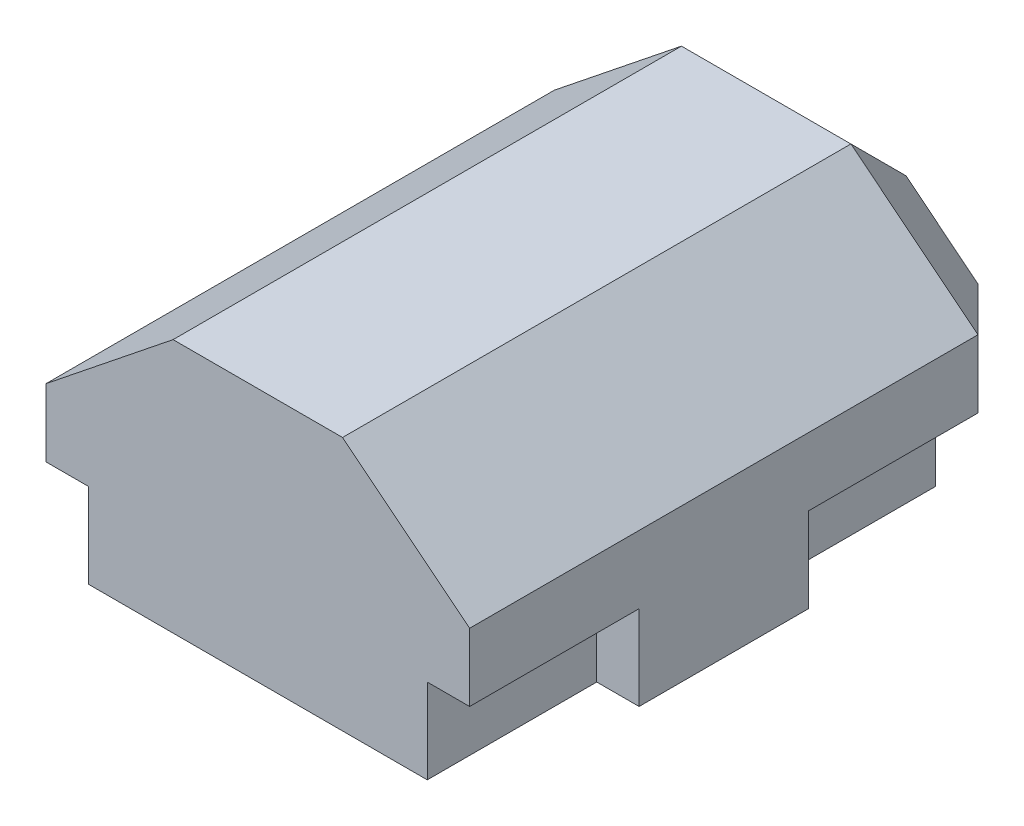
from build123d import *

# Parameters (mm, degrees)
BOSS_EXTRU_1_DEPTH = 600
ESQUISSE2_W        = 200
ESQUISSE2_H        = 100
BOSS_EXTRU_2_DEPTH = 500
BOSS_EXTRU_3_DEPTH = 100
CHANFREIN1_SIZE    = 100


with BuildPart() as part:
    # Esquisse1 → Boss.-Extru.1 (new body)
    with BuildSketch(Plane.XY):
        Polygon((-250, 30), (-100, 150), (100, 150), (250, 30), (250, -50), (200, -50), (200, -150), (-200, -150), (-200, -50), (-250, -50), align=None)
    extrude(amount=BOSS_EXTRU_1_DEPTH)

    # Esquisse2 → Boss.-Extru.2 (add)
    with BuildSketch(Plane.ZY.offset(250)):
        with Locations((300, -100)):
            Rectangle(ESQUISSE2_W, ESQUISSE2_H)
    extrude(amount=-BOSS_EXTRU_2_DEPTH)

    # Esquisse3 → Boss.-Extru.3 (add)
    with BuildSketch(Plane(origin=(0, 0, 0), x_dir=(-1, 0, 0), z_dir=(0, 0, -1))):
        Polygon((-200, -50), (200, -50), (250, -50), (250, 30), (100, 150), (-100, 150), (-250, 30), (-250, -50), align=None)
    extrude(amount=BOSS_EXTRU_3_DEPTH)

    # Chanfrein1
    chanfrein1_edges = [part.edges().sort_by_distance(p)[0] for p in [
        (-250, -10, -100),
        (-175, 90, -100),
        (0, 150, -100),
        (175, 90, -100),
        (250, -10, -100),
    ]]
    chamfer(chanfrein1_edges, length=CHANFREIN1_SIZE)


solid = part.part
